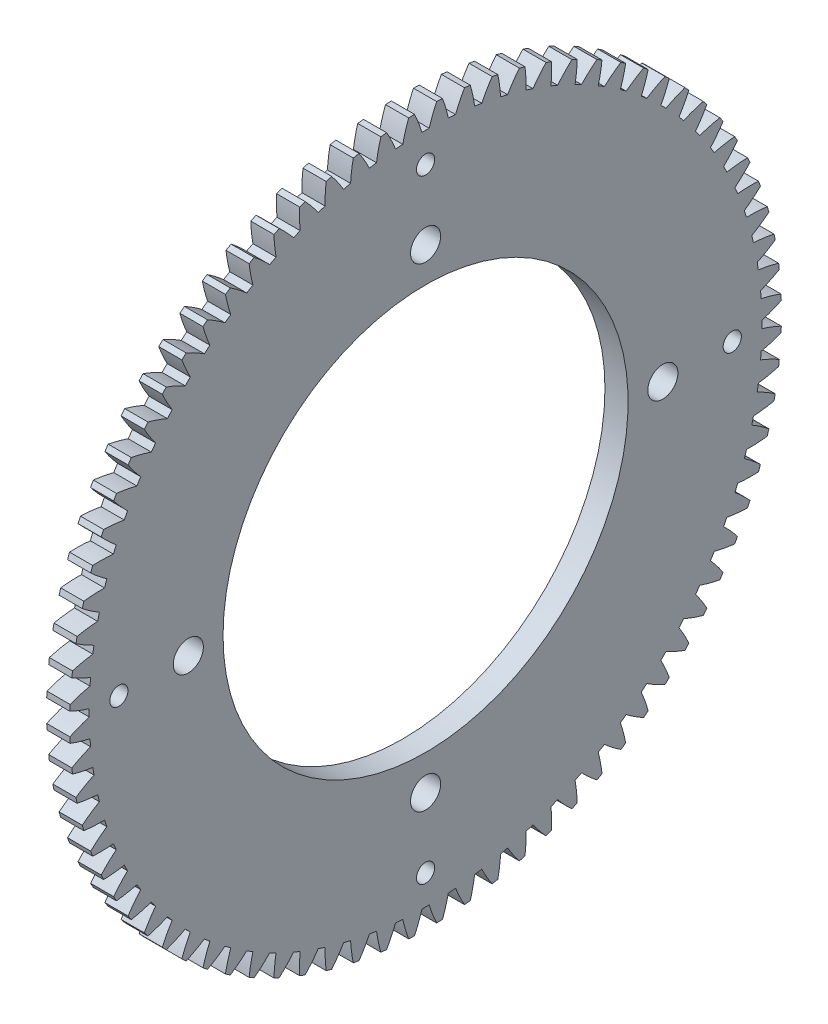
from build123d import *

# Parameters (mm, degrees)
BASPROSKE_W         = 4
BASPROSKE_H         = 61.5
TOOTHCUT_DEPTH      = 88.066066869
TEETHCUTS_COUNT     = 80
TEETHCUTS_ANGLE     = 355.5
BORSKE_R            = 35
BORE_DEPTH          = 50.0000508
SKETCH_2_R          = 2.6
SKETCH_2_R_2        = 1.575
CUT_EXTRUDE_1_DEPTH = 88.02403215


with BuildPart() as part:
    # BasProSke → Base-Revolve (revolve)
    with BuildSketch(Plane(origin=(0, 0, 0), x_dir=(1, 0, 0), z_dir=(0, 1, 0)), mode=Mode.PRIVATE) as base_revolve_sk:
        with Locations((2, 30.75)):
            Rectangle(BASPROSKE_W, BASPROSKE_H)
    revolve(base_revolve_sk.sketch.rotate(Axis((-10, 0, 0), (1, 0, 0)), 180), axis=Axis((-10, 0, 0), (1, 0, 0)))

    # TooCutSke → ToothCut (cut, through all)
    with BuildSketch(Plane(origin=(0, 0, 0), x_dir=(0, 0, -1), z_dir=(1, 0, 0))):
        with BuildLine():
            ThreePointArc((0.624201484, 58.120648211), (0, 58.124), (-0.624201484, 58.120648211))
            ThreePointArc((-0.624201484, 58.120648211), (-1.21079476, 59.832499178), (-1.924699975, 61.495287422))
            ThreePointArc((-1.924699975, 61.495287422), (0, 61.5254), (1.924699975, 61.495287422))
            ThreePointArc((1.924699975, 61.495287422), (1.21079476, 59.832499178), (0.624201484, 58.120648211))
        make_face()
    toothcut = extrude(amount=TOOTHCUT_DEPTH, mode=Mode.SUBTRACT)

    # TeethCuts: ToothCut ×80 about axis
    teethcuts_axis = Axis((-10, 0, 0), (1, 0, 0))
    for i in range(1, TEETHCUTS_COUNT):
        add(toothcut.rotate(teethcuts_axis, i * TEETHCUTS_ANGLE / (TEETHCUTS_COUNT - 1)), mode=Mode.SUBTRACT)

    # BorSke → Bore (cut, symmetric)
    with BuildSketch(Plane(origin=(0, 0, 0), x_dir=(0, 0, -1), z_dir=(1, 0, 0))):
        with Locations(Location((0, 0, 0), (0, 0, 180))):
            Circle(BORSKE_R)
    extrude(amount=BORE_DEPTH, both=True, mode=Mode.SUBTRACT)

    # 草图2 → 切除-拉伸1 (cut, through all)
    with BuildSketch(Plane(origin=(4, 0, 0), x_dir=(0, 0, -1), z_dir=(1, 0, 0))):
        with Locations((0, 41)):
            Circle(SKETCH_2_R)
        with Locations((41, 0)):
            Circle(SKETCH_2_R)
        with Locations((0, -41)):
            Circle(SKETCH_2_R)
        with Locations((-41, 0)):
            Circle(SKETCH_2_R)
        with Locations((0, 53)):
            Circle(SKETCH_2_R_2)
        with Locations((53, 0)):
            Circle(SKETCH_2_R_2)
        with Locations((0, -53)):
            Circle(SKETCH_2_R_2)
        with Locations((-53, 0)):
            Circle(SKETCH_2_R_2)
    extrude(amount=-CUT_EXTRUDE_1_DEPTH, mode=Mode.SUBTRACT)


solid = part.part
